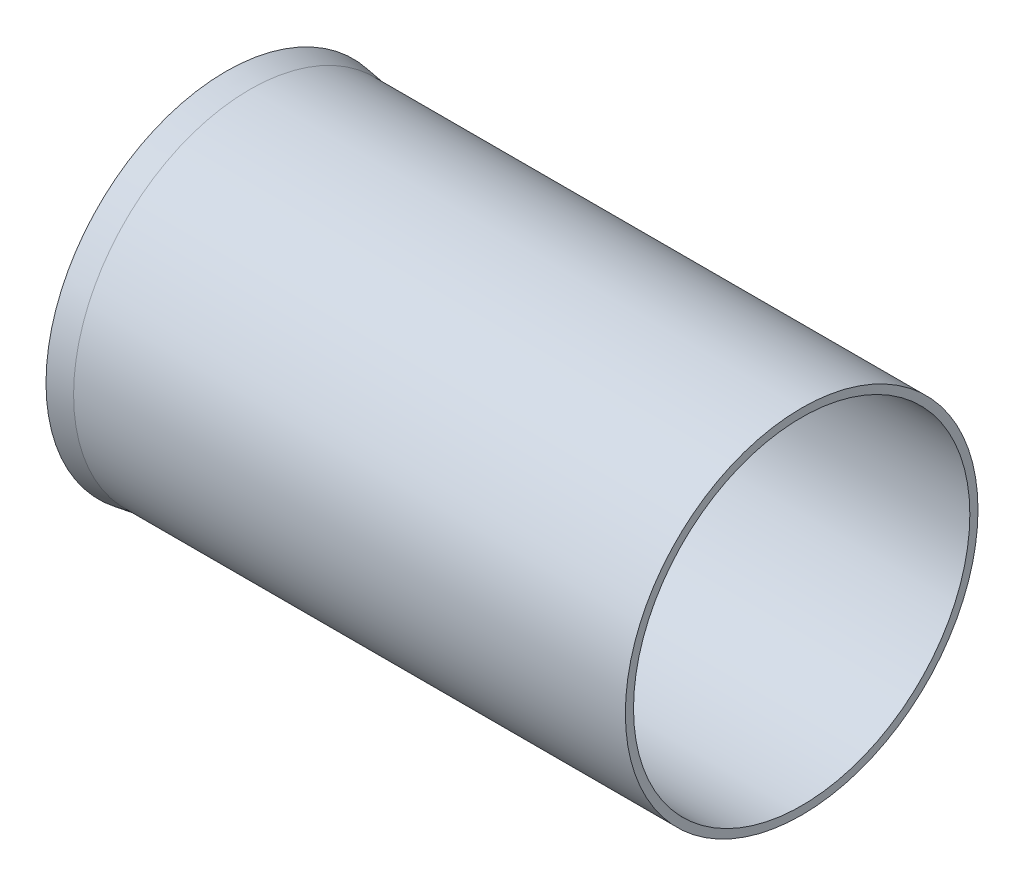
from build123d import *


with BuildPart() as part:
    # Esboço2 → Revolução1 (revolve)
    with BuildSketch(Plane.XY, mode=Mode.PRIVATE) as revolu_o1_sk:
        Polygon((0, 3.75), (0.5, 3.675), (12, 3.675), (12, 3.505), (0.487320923, 3.505), (-0.025217877, 3.58188082), align=None)
    revolve(revolu_o1_sk.sketch.rotate(Axis((0, 0, 0), (1, 0, 0)), 90), axis=Axis((0, 0, 0), (1, 0, 0)))


solid = part.part
